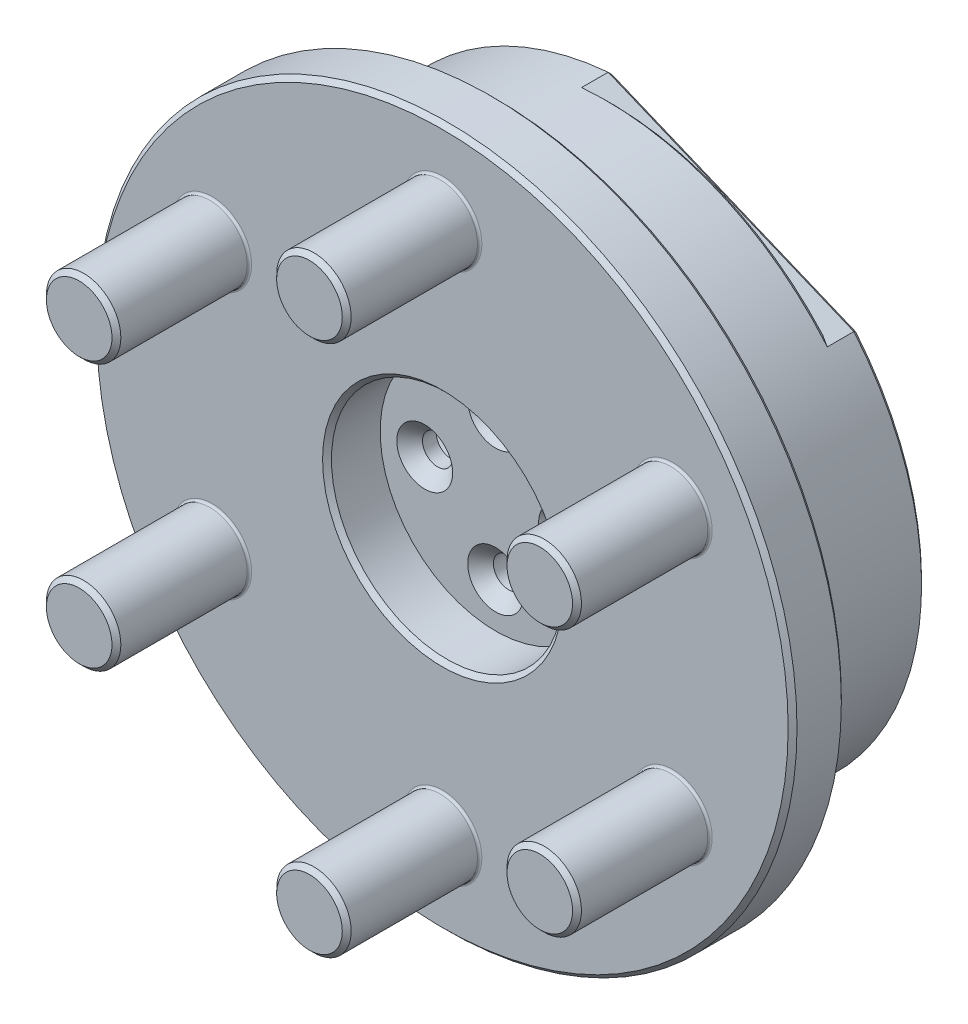
from build123d import *

# Parameters (mm, degrees)
SKETCH1_R                                           = 39.5
SKETCH1_R_2                                         = 13.025
BOSS_EXTRUDE1_DEPTH                                 = 6
SKETCH1_3_R                                         = 4.2
BOSS_EXTRUDE2_DEPTH                                 = 15
SKETCH2_R                                           = 32.55
BOSS_EXTRUDE3_DEPTH                                 = 16
M5_TAPPED_HOLE1_D                                   = 4.2
M5_TAPPED_HOLE1_DEPTH                               = 7
M5_TAPPED_HOLE1_CSINK_D                             = 5.05
M5_TAPPED_HOLE1_CSINK_ANGLE                         = 90
M5_TAPPED_HOLE1_TIP                                 = 1.2618073
CUT_EXTRUDE1_DEPTH                                  = 12
CUT_EXTRUDE2_START                                  = -3
CUT_EXTRUDE2_DEPTH                                  = 3
FILLET2_R                                           = 0.25
CHAMFER1_SIZE                                       = 0.5
CHAMFER2_SIZE                                       = 0.5
SKETCH11_R                                          = 11.05
CUT_EXTRUDE3_DEPTH                                  = 1
CHAMFER3_SIZE                                       = 0.25
CSK_FOR_M3_COUNTERSUNK_FLAT_HEAD_SCREW1_D           = 3.4
CSK_FOR_M3_COUNTERSUNK_FLAT_HEAD_SCREW1_CSINK_D     = 6.3
CSK_FOR_M3_COUNTERSUNK_FLAT_HEAD_SCREW1_CSINK_ANGLE = 90


with BuildPart() as part:
    # Sketch1 → Boss-Extrude1 (new body)
    with BuildSketch(Plane.XY):
        Circle(SKETCH1_R)
        Circle(SKETCH1_R_2, mode=Mode.SUBTRACT)
    extrude(amount=-BOSS_EXTRUDE1_DEPTH)

    # Sketch1<3> → Boss-Extrude2 (add)
    with BuildSketch(Plane.XY):
        with Locations((0, 30)):
            Circle(SKETCH1_3_R)
        with Locations((25.980762114, 15)):
            Circle(SKETCH1_3_R)
        with Locations((25.980762114, -15)):
            Circle(SKETCH1_3_R)
        with Locations((0, -30)):
            Circle(SKETCH1_3_R)
        with Locations((-25.980762114, -15)):
            Circle(SKETCH1_3_R)
        with Locations((-25.980762114, 15)):
            Circle(SKETCH1_3_R)
    extrude(amount=BOSS_EXTRUDE2_DEPTH)

    # Sketch2 → Boss-Extrude3 (add)
    with BuildSketch(Plane(origin=(0, 0, -6), x_dir=(-1, 0, 0), z_dir=(0, 0, -1))):
        Circle(SKETCH2_R)
    extrude(amount=BOSS_EXTRUDE3_DEPTH)

    # M5 Tapped Hole1
    with Locations(Plane(origin=(0, 0, -22), x_dir=(-1, 0, 0), z_dir=(0, 0, -1))):
        with Locations((0, 25), (-17.67766953, 17.67766953), (-25, 0), (17.67766953, 17.67766953), (25, 0), (-17.67766953, -17.67766953), (0, -25), (17.67766953, -17.67766953)):
            CounterSinkHole(M5_TAPPED_HOLE1_D / 2, M5_TAPPED_HOLE1_CSINK_D / 2, depth=M5_TAPPED_HOLE1_DEPTH, counter_sink_angle=M5_TAPPED_HOLE1_CSINK_ANGLE)
            with Locations((0, 0, -(M5_TAPPED_HOLE1_DEPTH + M5_TAPPED_HOLE1_TIP / 2))):  # 118° drill point
                Cone(0, M5_TAPPED_HOLE1_D / 2, M5_TAPPED_HOLE1_TIP, mode=Mode.SUBTRACT)

    # Sketch9 → Cut-Extrude1 (cut)
    with BuildSketch(Plane(origin=(0, 0, -22), x_dir=(-1, 0, 0), z_dir=(0, 0, -1))):
        with BuildLine():
            ThreePointArc((-12.930942405, 13.230295859), (-13.081475452, 13.081475452), (-13.230295859, 12.930942405))
            ThreePointArc((-13.230295859, 12.930942405), (-14.781693029, 12.087257279), (-16.53893977, 12.262533233))
            ThreePointArc((-16.53893977, 12.262533233), (-23.096988313, 9.567085809), (-20.365716868, 3.023876062))
            ThreePointArc((-20.365716868, 3.023876062), (-18.999216966, 1.90525379), (-18.498788981, 0.211674858))
            ThreePointArc((-18.498788981, 0.211674858), (-18.5, 0), (-18.498788981, -0.211674858))
            ThreePointArc((-18.498788981, -0.211674858), (-18.999216966, -1.90525379), (-20.365716868, -3.023876062))
            ThreePointArc((-20.365716868, -3.023876062), (-23.096988313, -9.567085809), (-16.53893977, -12.262533233))
            ThreePointArc((-16.53893977, -12.262533233), (-14.781693029, -12.087257279), (-13.230295859, -12.930942405))
            ThreePointArc((-13.230295859, -12.930942405), (-13.081475452, -13.081475452), (-12.930942405, -13.230295859))
            ThreePointArc((-12.930942405, -13.230295859), (-12.087257279, -14.781693029), (-12.262533233, -16.53893977))
            ThreePointArc((-12.262533233, -16.53893977), (-9.567085809, -23.096988313), (-3.023876062, -20.365716868))
            ThreePointArc((-3.023876062, -20.365716868), (-1.90525379, -18.999216966), (-0.211674858, -18.498788981))
            ThreePointArc((-0.211674858, -18.498788981), (0, -18.5), (0.211674858, -18.498788981))
            ThreePointArc((0.211674858, -18.498788981), (1.90525379, -18.999216966), (3.023876062, -20.365716868))
            ThreePointArc((3.023876062, -20.365716868), (9.567085809, -23.096988313), (12.262533233, -16.53893977))
            ThreePointArc((12.262533233, -16.53893977), (12.087257279, -14.781693029), (12.930942405, -13.230295859))
            ThreePointArc((12.930942405, -13.230295859), (13.081475452, -13.081475452), (13.230295859, -12.930942405))
            ThreePointArc((13.230295859, -12.930942405), (14.781693029, -12.087257279), (16.53893977, -12.262533233))
            ThreePointArc((16.53893977, -12.262533233), (23.096988313, -9.567085809), (20.365716868, -3.023876062))
            ThreePointArc((20.365716868, -3.023876062), (18.999216966, -1.90525379), (18.498788981, -0.211674858))
            ThreePointArc((18.498788981, -0.211674858), (18.5, 0), (18.498788981, 0.211674858))
            ThreePointArc((18.498788981, 0.211674858), (18.999216966, 1.90525379), (20.365716868, 3.023876062))
            ThreePointArc((20.365716868, 3.023876062), (23.096988313, 9.567085809), (16.53893977, 12.262533233))
            ThreePointArc((16.53893977, 12.262533233), (14.781693029, 12.087257279), (13.230295859, 12.930942405))
            ThreePointArc((13.230295859, 12.930942405), (13.081475452, 13.081475452), (12.930942405, 13.230295859))
            ThreePointArc((12.930942405, 13.230295859), (12.087257279, 14.781693029), (12.262533233, 16.53893977))
            ThreePointArc((12.262533233, 16.53893977), (9.567085809, 23.096988313), (3.023876062, 20.365716868))
            ThreePointArc((3.023876062, 20.365716868), (1.90525379, 18.999216966), (0.211674858, 18.498788981))
            ThreePointArc((0.211674858, 18.498788981), (0, 18.5), (-0.211674858, 18.498788981))
            ThreePointArc((-0.211674858, 18.498788981), (-1.90525379, 18.999216966), (-3.023876062, 20.365716868))
            ThreePointArc((-3.023876062, 20.365716868), (-9.567085809, 23.096988313), (-12.262533233, 16.53893977))
            ThreePointArc((-12.262533233, 16.53893977), (-12.087257279, 14.781693029), (-12.930942405, 13.230295859))
        make_face()
    extrude(amount=-CUT_EXTRUDE1_DEPTH, mode=Mode.SUBTRACT)

    # Sketch10 → Cut-Extrude2 (cut)
    with BuildSketch(Plane(origin=(0, 0, -22), x_dir=(-1, 0, 0), z_dir=(0, 0, -1)).offset(CUT_EXTRUDE2_START)):
        with BuildLine():
            Line((24.91305896, -20.948555875), (-2.803327015, -32.429058846))
            ThreePointArc((-2.803327015, -32.429058846), (12.456345723, -30.072278783), (24.91305896, -20.948555875))
        make_face()
        with BuildLine():
            Line((-24.91305896, 20.948555875), (2.803327015, 32.429058846))
            ThreePointArc((2.803327015, 32.429058846), (-12.456345723, 30.072278783), (-24.91305896, 20.948555875))
        make_face()
    extrude(amount=CUT_EXTRUDE2_DEPTH, mode=Mode.SUBTRACT)

    # Fillet2
    fillet2_edges = [part.edges().sort_by_distance(p)[0] for p in [
        (-4.2, -30, 0),
        (21.780762114, -15, 0),
        (-30.180762114, -15, 0),
        (21.780762114, 15, 0),
        (-30.180762114, 15, 0),
        (-4.2, 30, 0),
    ]]
    fillet(fillet2_edges, radius=FILLET2_R)

    # Chamfer1
    chamfer1_edges = [part.edges().sort_by_distance(p)[0] for p in [
        (21.780762114, -15, 15),
        (-4.2, -30, 15),
        (-30.180762114, -15, 15),
        (21.780762114, 15, 15),
        (-4.2, 30, 15),
        (-30.180762114, 15, 15),
    ]]
    chamfer(chamfer1_edges, length=CHAMFER1_SIZE)

    # Chamfer2
    chamfer2_edges = [part.edges().sort_by_distance(p)[0] for p in [
        (13.081475452, 13.081475452, -22),
        (-12.456345723, -30.072278783, -19),
        (-13.025, 0, 0),
        (12.456345723, 30.072278783, -19),
        (30.072278783, -12.456345723, -22),
        (11.054865972, 26.688807361, -22),
        (-23.986983912, 22.002888511, -22),
        (-39.5, 0, -6),
        (-39.5, 0, 0),
        (-13.081475452, -13.081475452, -22),
        (-14.781693029, -12.087257279, -22),
        (-12.087257279, -14.781693029, -22),
        (-23.096988313, -9.567085809, -22),
        (-9.567085809, -23.096988313, -22),
        (-18.999216966, -1.90525379, -22),
        (-1.90525379, -18.999216966, -22),
        (-18.5, 0, -22),
        (0, -18.5, -22),
        (-18.999216966, 1.90525379, -22),
        (1.90525379, -18.999216966, -22),
        (-23.096988313, 9.567085809, -22),
        (9.567085809, -23.096988313, -22),
        (-14.781693029, 12.087257279, -22),
        (12.087257279, -14.781693029, -22),
        (-13.081475452, 13.081475452, -22),
        (13.081475452, -13.081475452, -22),
        (-12.087257279, 14.781693029, -22),
        (14.781693029, -12.087257279, -22),
        (-9.567085809, 23.096988313, -22),
        (23.096988313, -9.567085809, -22),
        (-1.90525379, 18.999216966, -22),
        (18.999216966, -1.90525379, -22),
        (0, 18.5, -22),
        (18.5, 0, -22),
        (1.90525379, 18.999216966, -22),
        (18.999216966, 1.90525379, -22),
        (9.567085809, 23.096988313, -22),
        (23.096988313, 9.567085809, -22),
        (12.087257279, 14.781693029, -22),
        (14.781693029, 12.087257279, -22),
    ]]
    chamfer(chamfer2_edges, length=CHAMFER2_SIZE)

    # Sketch11 → Cut-Extrude3 (cut)
    with BuildSketch(Plane(origin=(0, 0, -10), x_dir=(-1, 0, 0), z_dir=(0, 0, -1))):
        Circle(SKETCH11_R)
    extrude(amount=-CUT_EXTRUDE3_DEPTH, mode=Mode.SUBTRACT)

    # Chamfer3
    chamfer3_edges = [part.edges().sort_by_distance(p)[0] for p in [
        (11.05, 0, -10),
    ]]
    chamfer(chamfer3_edges, length=CHAMFER3_SIZE)

    # CSK for M3 Countersunk Flat Head Screw1 (through all)
    with Locations(Plane.XY.offset(-6)):
        with Locations((0, 8), (-8, 0), (0, -8), (8, 0)):
            CounterSinkHole(CSK_FOR_M3_COUNTERSUNK_FLAT_HEAD_SCREW1_D / 2, CSK_FOR_M3_COUNTERSUNK_FLAT_HEAD_SCREW1_CSINK_D / 2, counter_sink_angle=CSK_FOR_M3_COUNTERSUNK_FLAT_HEAD_SCREW1_CSINK_ANGLE)


solid = part.part
